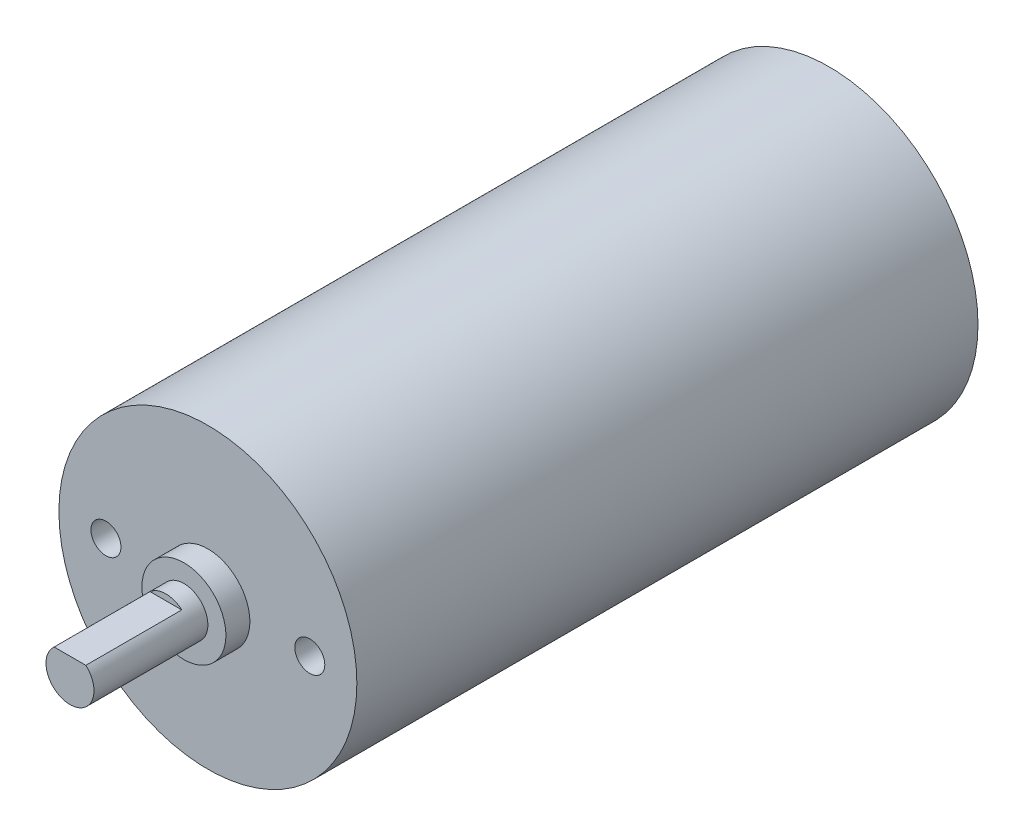
from build123d import *

# Parameters (mm, degrees)
BOSS_EXTRUDE1_DEPTH   = 8
BOSS_EXTRUDE2_START   = 1.5
SKETCH2_R             = 2
BOSS_EXTRUDE2_DEPTH   = 1.5
SKETCH3_R             = 3.5
BOSS_EXTRUDE3_DEPTH   = 2
SKETCH4_R             = 12.425
BOSS_EXTRUDE4_DEPTH   = 51.8
M3_TAPPED_HOLE1_D     = 2.5
M3_TAPPED_HOLE1_DEPTH = 12.7
M3_TAPPED_HOLE1_TIP   = 0.751075774


with BuildPart() as part:
    # Sketch1 → Boss-Extrude1 (new body)
    with BuildSketch(Plane.XY):
        with BuildLine():
            Line((-1.322875656, 1.5), (1.322875656, 1.5))
            ThreePointArc((1.322875656, 1.5), (0, -2), (-1.322875656, 1.5))
        make_face()
    extrude(amount=BOSS_EXTRUDE1_DEPTH)

    # Sketch2 → Boss-Extrude2 (add)
    with BuildSketch(Plane(origin=(0, 0, 0), x_dir=(-1, 0, 0), z_dir=(0, 0, -1)).offset(BOSS_EXTRUDE2_START)):
        Circle(SKETCH2_R)
    extrude(amount=-BOSS_EXTRUDE2_DEPTH)

    # Sketch3 → Boss-Extrude3 (add)
    with BuildSketch(Plane(origin=(0, 0, -1.5), x_dir=(-1, 0, 0), z_dir=(0, 0, -1))):
        Circle(SKETCH3_R)
    extrude(amount=BOSS_EXTRUDE3_DEPTH)

    # Sketch4 → Boss-Extrude4 (add)
    with BuildSketch(Plane(origin=(0, 0, -3.5), x_dir=(-1, 0, 0), z_dir=(0, 0, -1))):
        with Locations(Location((0, 0, 0), (0, 0, 180))):
            Circle(SKETCH4_R)
    extrude(amount=BOSS_EXTRUDE4_DEPTH)

    # M3 Tapped Hole1
    with Locations(Plane.XY.offset(-3.5)):
        with Locations((8.5, 0), (-8.5, 0)):
            Hole(M3_TAPPED_HOLE1_D / 2, depth=M3_TAPPED_HOLE1_DEPTH)
            with Locations((0, 0, -(M3_TAPPED_HOLE1_DEPTH + M3_TAPPED_HOLE1_TIP / 2))):  # 118° drill point
                Cone(0, M3_TAPPED_HOLE1_D / 2, M3_TAPPED_HOLE1_TIP, mode=Mode.SUBTRACT)


solid = part.part
